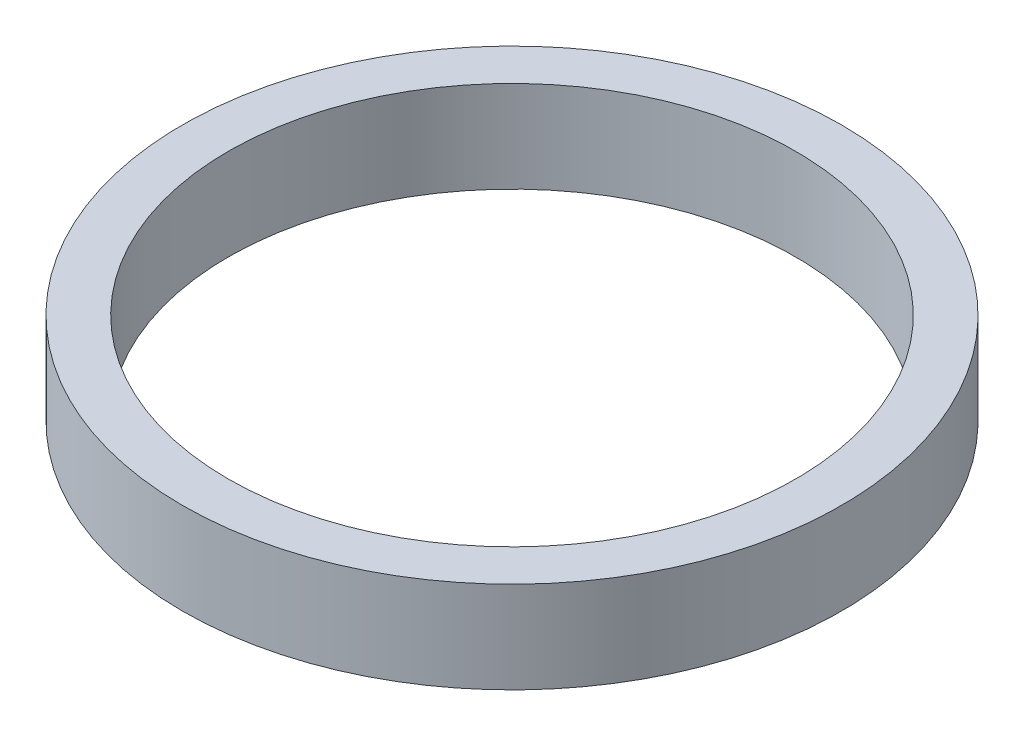
from build123d import *

# Parameters (mm, degrees)
SKETCH_1_R          = 36
EXTRUDE_1_DEPTH     = 10
SKETCH_2_R          = 31
CUT_EXTRUDE_1_DEPTH = 30


with BuildPart() as part:
    # 草圖1 → 填料-伸長1 (new body)
    with BuildSketch(Plane(origin=(0, 0, 0), x_dir=(1, 0, 0), z_dir=(0, 1, 0))):
        with Locations(Location((0, 0, 0), (0, 0, 270))):
            Circle(SKETCH_1_R)
    extrude(amount=EXTRUDE_1_DEPTH)

    # 草圖2 → 除料-伸長1 (cut)
    with BuildSketch(Plane(origin=(0, 10, 0), x_dir=(1, 0, 0), z_dir=(0, 1, 0))):
        with Locations(Location((0, 0, 0), (0, 0, 270))):
            Circle(SKETCH_2_R)
    extrude(amount=-CUT_EXTRUDE_1_DEPTH, mode=Mode.SUBTRACT)


solid = part.part
